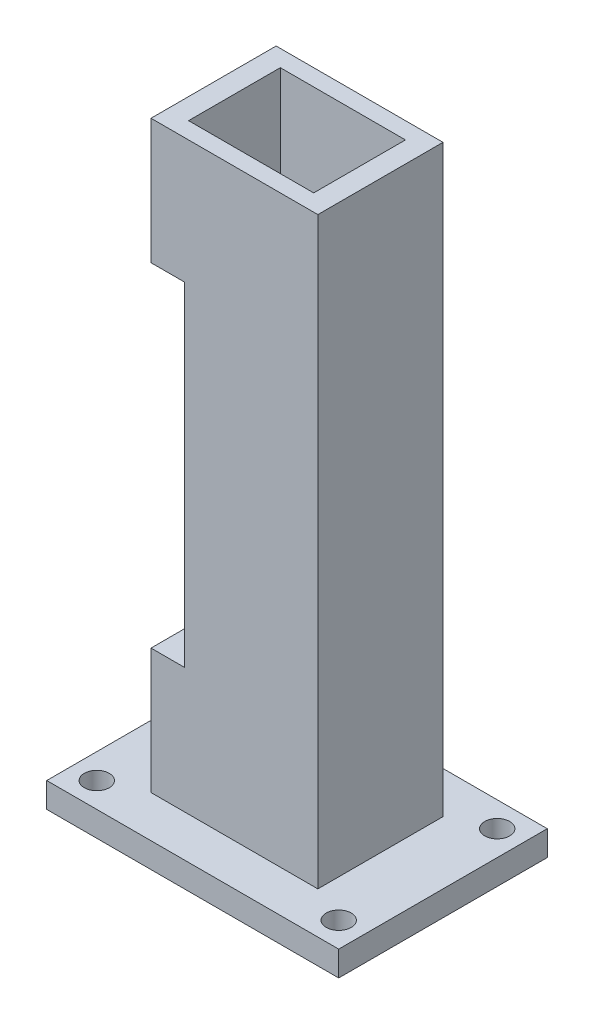
from build123d import *

# Parameters (mm, degrees)
SKETCH_1_W          = 35
SKETCH_1_H          = 25
EXTRUDE_1_DEPTH     = 3
SKETCH_2_W          = 20
SKETCH_2_H          = 15
EXTRUDE_2_DEPTH     = 70
CUT_EXTRUDE_1_REACH = 78.102
SKETCH_3_W          = 15
SKETCH_3_H          = 11
CUT_EXTRUDE_2_REACH = 79.687
SKETCH_4_W          = 4
SKETCH_4_H          = 40
CUT_EXTRUDE_3_REACH = 75.229
SKETCH_5_R          = 1.5


with BuildPart() as part:
    # 草图1 → 凸台-拉伸1 (new body)
    with BuildSketch(Plane(origin=(0, 0, 0), x_dir=(1, 0, 0), z_dir=(0, 1, 0))):
        Rectangle(SKETCH_1_W, SKETCH_1_H)
    extrude(amount=EXTRUDE_1_DEPTH)

    # 草图2 → 凸台-拉伸2 (add)
    with BuildSketch(Plane(origin=(0, 3, 0), x_dir=(1, 0, 0), z_dir=(0, 1, 0))):
        Rectangle(SKETCH_2_W, SKETCH_2_H)
    extrude(amount=EXTRUDE_2_DEPTH)

    # 草图3 → 切除-拉伸1 (cut, up to next)
    with BuildSketch(Plane(origin=(0, 73, 0), x_dir=(1, 0, 0), z_dir=(0, 1, 0)), mode=Mode.PRIVATE) as cut_extrude_1_sk1:
        Rectangle(SKETCH_3_W, SKETCH_3_H)
    cut_extrude_1_tool1 = extrude(cut_extrude_1_sk1.sketch, amount=-CUT_EXTRUDE_1_REACH, mode=Mode.PRIVATE) & part.part
    add(cut_extrude_1_tool1.solids().sort_by_distance((0, 73, 0))[0], mode=Mode.SUBTRACT)

    # 草图4 → 切除-拉伸2 (cut, up to next)
    with BuildSketch(Plane.XY.offset(7.5), mode=Mode.PRIVATE) as cut_extrude_2_sk1:
        with Locations((-8, 38)):
            Rectangle(SKETCH_4_W, SKETCH_4_H)
    cut_extrude_2_tool1 = extrude(cut_extrude_2_sk1.sketch, amount=-CUT_EXTRUDE_2_REACH, mode=Mode.PRIVATE) & part.part
    add(cut_extrude_2_tool1.solids().sort_by_distance((-8, 38, 7.5))[0], mode=Mode.SUBTRACT)

    # 草图5 → 切除-拉伸3 (cut, up to next)
    with BuildSketch(Plane(origin=(0, 3, 0), x_dir=(1, 0, 0), z_dir=(0, 1, 0)), mode=Mode.PRIVATE) as cut_extrude_3_sk1:
        with Locations(Location((-14.5, 9.5, 0), (0, 0, 270))):
            Circle(SKETCH_5_R)
    cut_extrude_3_tool1 = extrude(cut_extrude_3_sk1.sketch, amount=-CUT_EXTRUDE_3_REACH, mode=Mode.PRIVATE) & part.part
    # 草图5 → 切除-拉伸3 (cut, up to next)
    with BuildSketch(Plane(origin=(0, 3, 0), x_dir=(1, 0, 0), z_dir=(0, 1, 0)), mode=Mode.PRIVATE) as cut_extrude_3_sk2:
        with Locations(Location((14.5, 9.5, 0), (0, 0, 270))):
            Circle(SKETCH_5_R)
    cut_extrude_3_tool2 = extrude(cut_extrude_3_sk2.sketch, amount=-CUT_EXTRUDE_3_REACH, mode=Mode.PRIVATE) & part.part
    # 草图5 → 切除-拉伸3 (cut, up to next)
    with BuildSketch(Plane(origin=(0, 3, 0), x_dir=(1, 0, 0), z_dir=(0, 1, 0)), mode=Mode.PRIVATE) as cut_extrude_3_sk3:
        with Locations(Location((-14.5, -9.5, 0), (0, 0, 270))):
            Circle(SKETCH_5_R)
    cut_extrude_3_tool3 = extrude(cut_extrude_3_sk3.sketch, amount=-CUT_EXTRUDE_3_REACH, mode=Mode.PRIVATE) & part.part
    # 草图5 → 切除-拉伸3 (cut, up to next)
    with BuildSketch(Plane(origin=(0, 3, 0), x_dir=(1, 0, 0), z_dir=(0, 1, 0)), mode=Mode.PRIVATE) as cut_extrude_3_sk4:
        with Locations(Location((14.5, -9.5, 0), (0, 0, 270))):
            Circle(SKETCH_5_R)
    cut_extrude_3_tool4 = extrude(cut_extrude_3_sk4.sketch, amount=-CUT_EXTRUDE_3_REACH, mode=Mode.PRIVATE) & part.part
    add(cut_extrude_3_tool1.solids().sort_by_distance((-14.5, 3, -9.5))[0], mode=Mode.SUBTRACT)
    add(cut_extrude_3_tool2.solids().sort_by_distance((14.5, 3, -9.5))[0], mode=Mode.SUBTRACT)
    add(cut_extrude_3_tool3.solids().sort_by_distance((-14.5, 3, 9.5))[0], mode=Mode.SUBTRACT)
    add(cut_extrude_3_tool4.solids().sort_by_distance((14.5, 3, 9.5))[0], mode=Mode.SUBTRACT)


solid = part.part
